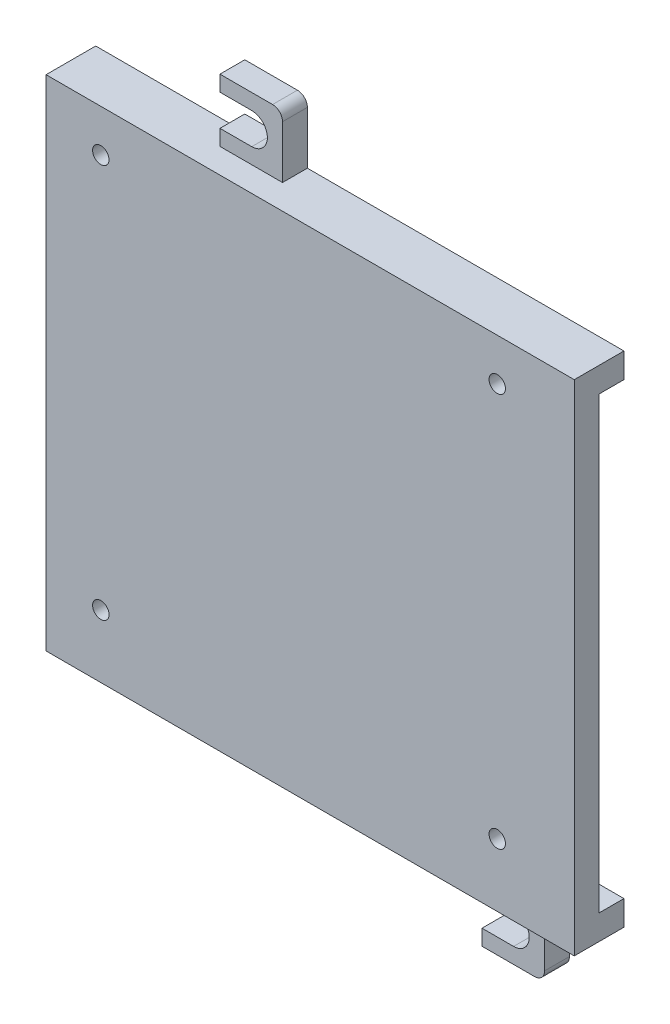
from build123d import *

# Parameters (mm, degrees)
SKETCH1_R                = 2.1
BOSS_EXTRUDE1_DEPTH      = 6.35
BOSS_EXTRUDE2_DEPTH      = 6.35
BOSS_EXTRUDE2_DEPTH_BACK = 6.35
SKETCH4_W                = 135.031416385
SKETCH4_H                = 6.35
BOSS_EXTRUDE3_DEPTH      = 6.35
FILLET2_R                = 2.54
FILLET3_R                = 2.54


with BuildPart() as part:
    # Sketch1 → Boss-Extrude1 (new body)
    with BuildSketch(Plane(origin=(0, 0, -64.874447619), x_dir=(-1, 0, 0), z_dir=(0, 0, -1))):
        Polygon((-199.169520933, -82.051755317), (-199.169520933, -111.544482171), (-199.169520933, -132.752289105), (-64.138104548, -132.752289105), (-64.138104548, -17.873289105), (-199.169520933, -17.873289105), align=None)
        with Locations((-179.484520933, -123.029289105)):
            Circle(SKETCH1_R, mode=Mode.SUBTRACT)
        with Locations((-78.138520933, -123.029289105)):
            Circle(SKETCH1_R, mode=Mode.SUBTRACT)
        with Locations((-179.484520933, -22.318289105)):
            Circle(SKETCH1_R, mode=Mode.SUBTRACT)
        with Locations((-78.138520933, -22.318289105)):
            Circle(SKETCH1_R, mode=Mode.SUBTRACT)
    extrude(amount=BOSS_EXTRUDE1_DEPTH)

    # Sketch4 → Boss-Extrude2 (add, two sides: drawn at the far end of the back side and taken through both)
    with BuildSketch(Plane(origin=(0, 0, -71.224447619), x_dir=(-1, 0, 0), z_dir=(0, 0, -1)).offset(-BOSS_EXTRUDE2_DEPTH_BACK)):
        with Locations((-131.653812741, -14.698289105)):
            Rectangle(SKETCH4_W, SKETCH4_H)
        with Locations((-131.653812741, -135.927289105)):
            Rectangle(SKETCH4_W, SKETCH4_H)
    extrude(amount=BOSS_EXTRUDE2_DEPTH + BOSS_EXTRUDE2_DEPTH_BACK)

    # Sketch5 → Boss-Extrude3 (add)
    with BuildSketch(Plane(origin=(0, 0, -77.574447619), x_dir=(-1, 0, 0), z_dir=(0, 0, -1))):
        with BuildLine():
            Line((-118.238104548, 4.476710895), (-118.238104548, -11.523289105))
            Line((-118.238104548, -11.523289105), (-102.238104548, -11.523289105))
            Line((-102.238104548, -11.523289105), (-102.238104548, -7.523289105))
            Line((-102.238104548, -7.523289105), (-110.364104548, -7.523289105))
            ThreePointArc((-110.364104548, -7.523289105), (-114.364104548, -3.523289105), (-110.364104548, 0.476710895))
            Line((-110.364104548, 0.476710895), (-102.238104548, 0.476710895))
            Line((-102.238104548, 0.476710895), (-102.238104548, 4.476710895))
            Line((-102.238104548, 4.476710895), (-118.238104548, 4.476710895))
        make_face()
        with BuildLine():
            Line((-169.23476894, -139.102289105), (-185.23476894, -139.102289105))
            Line((-185.23476894, -139.102289105), (-185.23476894, -155.102289105))
            Line((-185.23476894, -155.102289105), (-169.23476894, -155.102289105))
            Line((-169.23476894, -155.102289105), (-169.23476894, -151.102289105))
            Line((-169.23476894, -151.102289105), (-177.30996894, -151.102289105))
            ThreePointArc((-177.30996894, -151.102289105), (-181.30996894, -147.102289105), (-177.30996894, -143.102289105))
            Line((-177.30996894, -143.102289105), (-169.23476894, -143.102289105))
            Line((-169.23476894, -143.102289105), (-169.23476894, -139.102289105))
        make_face()
    extrude(amount=-BOSS_EXTRUDE3_DEPTH)

    # Fillet2
    fillet2_edges = [part.edges().sort_by_distance(p)[0] for p in [
        (118.238104548, 4.476710895, -74.399447619),
    ]]
    fillet(fillet2_edges, radius=FILLET2_R)

    # Fillet3
    fillet3_edges = [part.edges().sort_by_distance(p)[0] for p in [
        (185.23476894, -155.102289105, -74.399447619),
    ]]
    fillet(fillet3_edges, radius=FILLET3_R)


solid = part.part
